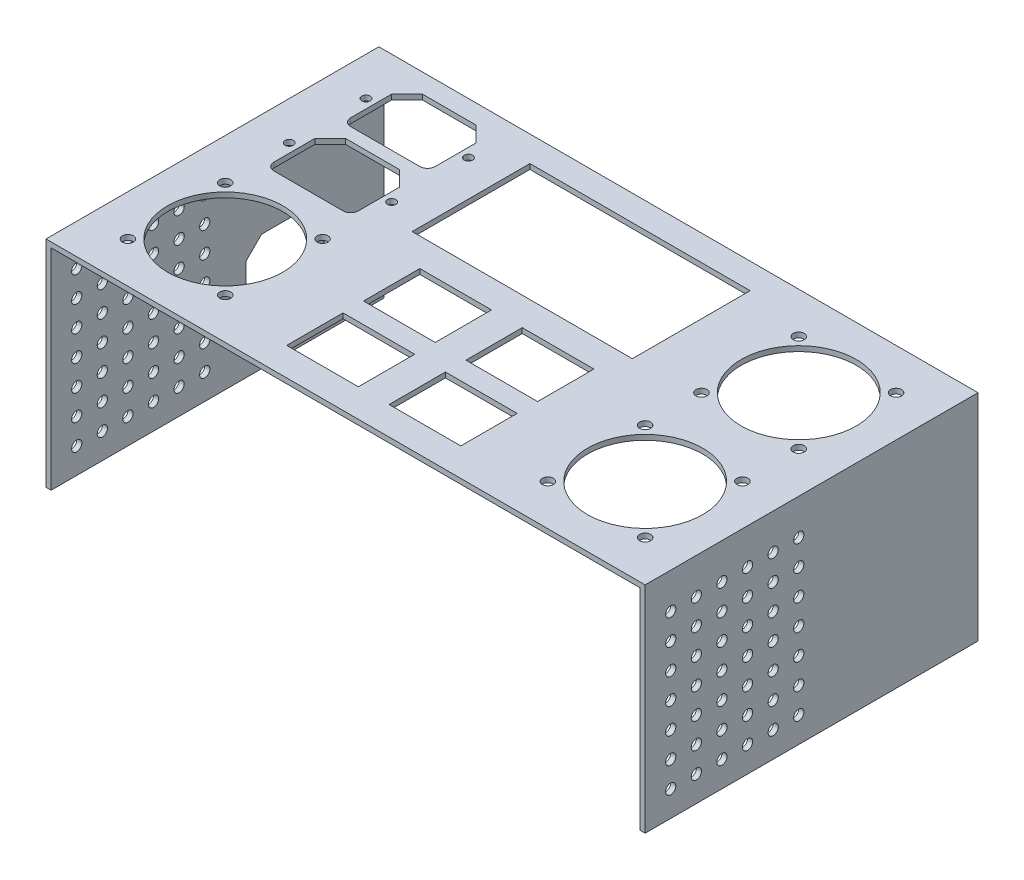
from build123d import *

# Parameters (mm, degrees)
EXTRUDE_1_DEPTH     = 130
SKETCH_4_R          = 22.5
SKETCH_4_R_2        = 2.15
SKETCH_4_R_3        = 1.65
SKETCH_4_W          = 28
SKETCH_4_H          = 22
SKETCH_4_W_2        = 86
SKETCH_4_H_2        = 46
CUT_EXTRUDE_1_DEPTH = 281.556589657
SKETCH_5_R          = 1.6
CUT_EXTRUDE_2_DEPTH = 10
SKETCH_6_R          = 2
CUT_EXTRUDE_3_DEPTH = 281.556589657


with BuildPart() as part:
    # Эскиз2 → Бобышка-Вытянуть1 (new body)
    with BuildSketch(Plane.XY):
        Polygon((2, 0), (2, 82), (232, 82), (232, 0), (234, 0), (234, 84), (0, 84), (0, 0), align=None)
    extrude(amount=EXTRUDE_1_DEPTH)

    # Эскиз4 → Вырез-Вытянуть1 (cut, through all)
    with BuildSketch(Plane(origin=(0, 84, 0), x_dir=(1, 0, 0), z_dir=(0, 1, 0))):
        with Locations(Location((35, -95, 0), (0, 0, 270))):
            Circle(SKETCH_4_R)
        with Locations(Location((54, -114, 0), (0, 0, 270))):
            Circle(SKETCH_4_R_2)
        with Locations(Location((16, -114, 0), (0, 0, 270))):
            Circle(SKETCH_4_R_2)
        with Locations(Location((16, -76, 0), (0, 0, 270))):
            Circle(SKETCH_4_R_2)
        with Locations(Location((54, -76, 0), (0, 0, 270))):
            Circle(SKETCH_4_R_2)
        with Locations(Location((15, -20, 0), (0, 0, 270))):
            Circle(SKETCH_4_R_3)
        with Locations(Location((55, -20, 0), (0, 0, 270))):
            Circle(SKETCH_4_R_3)
        with Locations(Location((15, -50, 0), (0, 0, 270))):
            Circle(SKETCH_4_R_3)
        with Locations(Location((55, -50, 0), (0, 0, 270))):
            Circle(SKETCH_4_R_3)
        with Locations(Location((199, -95, 0), (0, 0, 270))):
            Circle(SKETCH_4_R)
        with Locations(Location((218, -114, 0), (0, 0, 270))):
            Circle(SKETCH_4_R_2)
        with Locations(Location((180, -114, 0), (0, 0, 270))):
            Circle(SKETCH_4_R_2)
        with Locations(Location((180, -76, 0), (0, 0, 270))):
            Circle(SKETCH_4_R_2)
        with Locations(Location((218, -76, 0), (0, 0, 270))):
            Circle(SKETCH_4_R_2)
        with Locations(Location((199, -35, 0), (0, 0, 270))):
            Circle(SKETCH_4_R)
        with Locations(Location((218, -54, 0), (0, 0, 270))):
            Circle(SKETCH_4_R_2)
        with Locations(Location((180, -54, 0), (0, 0, 270))):
            Circle(SKETCH_4_R_2)
        with Locations(Location((180, -16, 0), (0, 0, 270))):
            Circle(SKETCH_4_R_2)
        with Locations(Location((218, -16, 0), (0, 0, 270))):
            Circle(SKETCH_4_R_2)
        with BuildLine():
            Line((24.5, -7.5), (45.5, -7.5))
            Line((45.5, -7.5), (51.5, -13.5))
            Line((51.5, -13.5), (51.5, -29.5))
            ThreePointArc((51.5, -29.5), (50.621320344, -31.621320344), (48.5, -32.5))
            Line((48.5, -32.5), (21.5, -32.5))
            ThreePointArc((21.5, -32.5), (19.378679656, -31.621320344), (18.5, -29.5))
            Line((18.5, -29.5), (18.5, -13.5))
            Line((18.5, -13.5), (24.5, -7.5))
        make_face()
        with Locations((97, -78)):
            Rectangle(SKETCH_4_W, SKETCH_4_H)
        with Locations((112, -33)):
            Rectangle(SKETCH_4_W_2, SKETCH_4_H_2)
        with BuildLine():
            Line((18.5, -43.5), (24.5, -37.5))
            Line((24.5, -37.5), (45.5, -37.5))
            Line((45.5, -37.5), (51.5, -43.5))
            Line((51.5, -43.5), (51.5, -59.5))
            ThreePointArc((51.5, -59.5), (50.621320344, -61.621320344), (48.5, -62.5))
            Line((48.5, -62.5), (21.5, -62.5))
            ThreePointArc((21.5, -62.5), (19.378679656, -61.621320344), (18.5, -59.5))
            Line((18.5, -59.5), (18.5, -43.5))
        make_face()
        with Locations((137, -78)):
            Rectangle(SKETCH_4_W, SKETCH_4_H)
        with Locations((137, -108)):
            Rectangle(SKETCH_4_W, SKETCH_4_H)
        with Locations((97, -108)):
            Rectangle(SKETCH_4_W, SKETCH_4_H)
    extrude(amount=-CUT_EXTRUDE_1_DEPTH, mode=Mode.SUBTRACT)

    # Эскиз5 → Вырез-Вытянуть2 (cut)
    with BuildSketch(Plane.ZY):
        with Locations((58, 30)):
            Circle(SKETCH_5_R)
        with Locations((22, 30)):
            Circle(SKETCH_5_R)
        with BuildLine():
            Line((32.2, 45.5), (47.8, 45.5))
            Line((47.8, 45.5), (53.8, 39.5))
            Line((53.8, 39.5), (53.8, 17.5))
            ThreePointArc((53.8, 17.5), (52.921320344, 15.378679656), (50.8, 14.5))
            Line((50.8, 14.5), (29.2, 14.5))
            ThreePointArc((29.2, 14.5), (27.078679656, 15.378679656), (26.2, 17.5))
            Line((26.2, 17.5), (26.2, 39.5))
            Line((26.2, 39.5), (32.2, 45.5))
        make_face()
    extrude(amount=-CUT_EXTRUDE_2_DEPTH, mode=Mode.SUBTRACT)

    # Эскиз6 → Вырез-Вытянуть3 (cut, through all)
    with BuildSketch(Plane.ZY):
        with Locations((70, 10)):
            Circle(SKETCH_6_R)
        with Locations((80, 10)):
            Circle(SKETCH_6_R)
        with Locations((90, 10)):
            Circle(SKETCH_6_R)
        with Locations((100, 10)):
            Circle(SKETCH_6_R)
        with Locations((110, 10)):
            Circle(SKETCH_6_R)
        with Locations((120, 10)):
            Circle(SKETCH_6_R)
        with Locations((80, 20)):
            Circle(SKETCH_6_R)
        with Locations((90, 20)):
            Circle(SKETCH_6_R)
        with Locations((100, 20)):
            Circle(SKETCH_6_R)
        with Locations((110, 20)):
            Circle(SKETCH_6_R)
        with Locations((120, 20)):
            Circle(SKETCH_6_R)
        with Locations((80, 30)):
            Circle(SKETCH_6_R)
        with Locations((90, 30)):
            Circle(SKETCH_6_R)
        with Locations((100, 30)):
            Circle(SKETCH_6_R)
        with Locations((110, 30)):
            Circle(SKETCH_6_R)
        with Locations((120, 30)):
            Circle(SKETCH_6_R)
        with Locations((80, 40)):
            Circle(SKETCH_6_R)
        with Locations((90, 40)):
            Circle(SKETCH_6_R)
        with Locations((100, 40)):
            Circle(SKETCH_6_R)
        with Locations((110, 40)):
            Circle(SKETCH_6_R)
        with Locations((120, 40)):
            Circle(SKETCH_6_R)
        with Locations((80, 50)):
            Circle(SKETCH_6_R)
        with Locations((90, 50)):
            Circle(SKETCH_6_R)
        with Locations((100, 50)):
            Circle(SKETCH_6_R)
        with Locations((110, 50)):
            Circle(SKETCH_6_R)
        with Locations((120, 50)):
            Circle(SKETCH_6_R)
        with Locations((80, 60)):
            Circle(SKETCH_6_R)
        with Locations((90, 60)):
            Circle(SKETCH_6_R)
        with Locations((100, 60)):
            Circle(SKETCH_6_R)
        with Locations((110, 60)):
            Circle(SKETCH_6_R)
        with Locations((120, 60)):
            Circle(SKETCH_6_R)
        with Locations((80, 70)):
            Circle(SKETCH_6_R)
        with Locations((90, 70)):
            Circle(SKETCH_6_R)
        with Locations((100, 70)):
            Circle(SKETCH_6_R)
        with Locations((110, 70)):
            Circle(SKETCH_6_R)
        with Locations((120, 70)):
            Circle(SKETCH_6_R)
        with Locations((70, 20)):
            Circle(SKETCH_6_R)
        with Locations((70, 30)):
            Circle(SKETCH_6_R)
        with Locations((70, 40)):
            Circle(SKETCH_6_R)
        with Locations((70, 50)):
            Circle(SKETCH_6_R)
        with Locations((70, 60)):
            Circle(SKETCH_6_R)
        with Locations((70, 70)):
            Circle(SKETCH_6_R)
    extrude(amount=-CUT_EXTRUDE_3_DEPTH, mode=Mode.SUBTRACT)


solid = part.part
